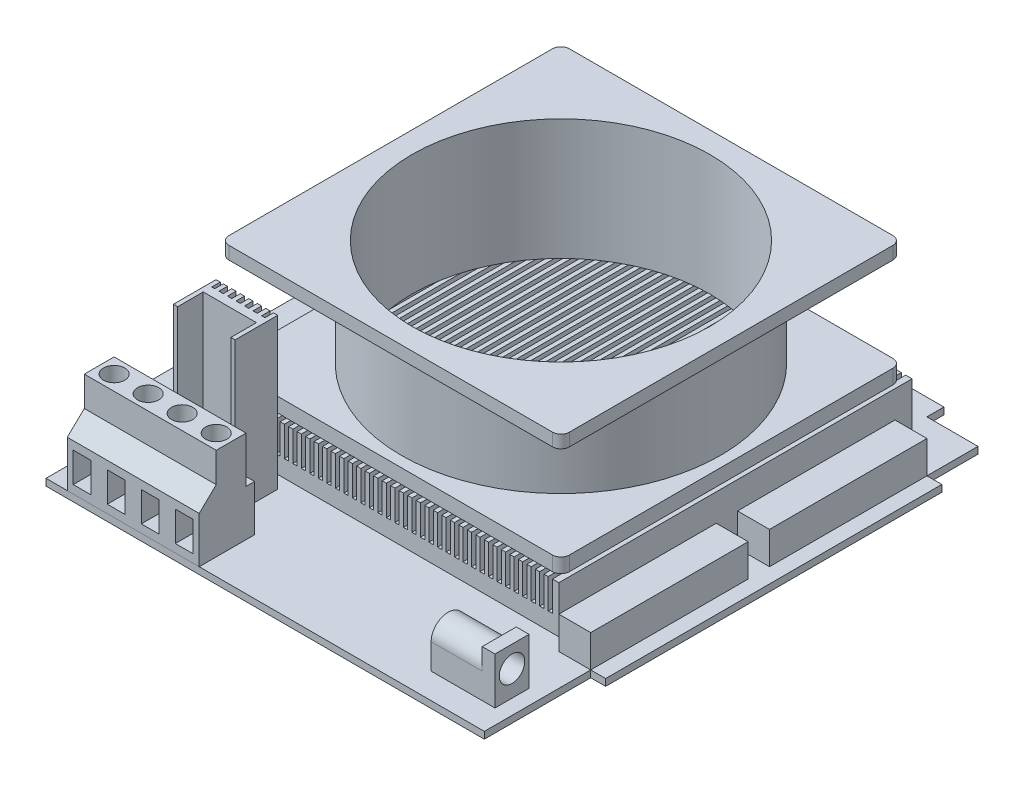
from build123d import *

# Parameters (mm, degrees)
SKETCH_2_W           = 12
SKETCH_2_H           = 25
SKETCH_2_W_2         = 3.5
SKETCH_2_H_2         = 79
SKETCH_2_H_3         = 12
SKETCH_2_W_3         = 79
SKETCH_2_H_4         = 4
EXTRUDE_1_DEPTH      = 1.6
SKETCH_3_W           = 7.5
SKETCH_3_H           = 79
EXTRUDE_2_DEPTH      = 7.6
EXTRUDE_2_2_DEPTH    = 7.6
SKETCH_4_W           = 82
SKETCH_4_H           = 83
EXTRUDE_3_DEPTH      = 11
EXTRUDE_4_DEPTH      = 28.4
SKETCH_8_W           = 1
SKETCH_8_H           = 8
CUT_EXTRUDE_2_DEPTH  = 115.4
SKETCH_6_W           = 31
SKETCH_6_H           = 13
EXTRUDE_5_DEPTH      = 21.7
EXTRUDE_6_DEPTH      = 35.4
SKETCH_9_W           = 130.811120825
SKETCH_9_H           = 105.268753278
SKETCH_9_R           = 37.5
CUT_EXTRUDE_3_DEPTH  = 22
SKETCH_10_R          = 35
CUT_EXTRUDE_4_DEPTH  = 45
SKETCH_11_W          = 103
SKETCH_11_H          = 5
CUT_EXTRUDE_5_DEPTH  = 25
SKETCH_13_W          = 2
SKETCH_13_H          = 10.85
CUT_EXTRUDE_8_DEPTH  = 45
SKETCH_14_R          = 2.5
CUT_EXTRUDE_9_DEPTH  = 15
SKETCH_15_W          = 4.2
SKETCH_15_H          = 7
CUT_EXTRUDE_10_DEPTH = 12
SKETCH_16_W          = 8
SKETCH_16_H          = 11
EXTRUDE_7_DEPTH      = 15
CUT_EXTRUDE_11_DEPTH = 12
SKETCH_18_R          = 3
CUT_EXTRUDE_12_DEPTH = 12


with BuildPart() as part:
    # 草图2 → 凸台-拉伸1 (new body)
    with BuildSketch(Plane(origin=(0, 0, 0), x_dir=(1, 0, 0), z_dir=(0, 1, 0))):
        with Locations((-45.5, -45.5)):
            Rectangle(SKETCH_2_W, SKETCH_2_H)
        with Locations((-53.25, 6.5)):
            Rectangle(SKETCH_2_W_2, SKETCH_2_H_2)
        with Locations((-45.5, 52)):
            Rectangle(SKETCH_2_W, SKETCH_2_H_3)
        with Locations((0, 60)):
            Rectangle(SKETCH_2_W_3, SKETCH_2_H_4)
        with Locations((45.5, 52)):
            Rectangle(SKETCH_2_W, SKETCH_2_H_3)
        with Locations((53.25, 6.5)):
            Rectangle(SKETCH_2_W_2, SKETCH_2_H_2)
        with Locations((45.5, -45.5)):
            Rectangle(SKETCH_2_W, SKETCH_2_H)
        with Locations((0, -45.5)):
            Rectangle(SKETCH_2_W_3, SKETCH_2_H)
        with Locations((0, 6.5)):
            Rectangle(SKETCH_2_W_3, SKETCH_2_H_2)
        with Locations((45.5, 6.5)):
            Rectangle(SKETCH_2_W, SKETCH_2_H_2)
        with Locations((-45.5, 6.5)):
            Rectangle(SKETCH_2_W, SKETCH_2_H_2)
        with Locations((0, 52)):
            Rectangle(SKETCH_2_W_3, SKETCH_2_H_3)
    extrude(amount=EXTRUDE_1_DEPTH)

    # 草图4 → 凸台-拉伸3 (add)
    with BuildSketch(Plane(origin=(0, 1.6, 0), x_dir=(1, 0, 0), z_dir=(0, 1, 0))):
        with Locations((0, 11.5)):
            Rectangle(SKETCH_4_W, SKETCH_4_H)
    extrude(amount=EXTRUDE_3_DEPTH)

    # 草图8 → 切除-拉伸2 (cut)
    with BuildSketch(Plane.XY.offset(30)):
        with Locations((39, 9.6)):
            Rectangle(SKETCH_8_W, SKETCH_8_H)
        with Locations((37, 9.6)):
            Rectangle(SKETCH_8_W, SKETCH_8_H)
        with Locations((35, 9.6)):
            Rectangle(SKETCH_8_W, SKETCH_8_H)
        with Locations((33, 9.6)):
            Rectangle(SKETCH_8_W, SKETCH_8_H)
        with Locations((31, 9.6)):
            Rectangle(SKETCH_8_W, SKETCH_8_H)
        with Locations((29, 9.6)):
            Rectangle(SKETCH_8_W, SKETCH_8_H)
        with Locations((27, 9.6)):
            Rectangle(SKETCH_8_W, SKETCH_8_H)
        with Locations((25, 9.6)):
            Rectangle(SKETCH_8_W, SKETCH_8_H)
        with Locations((23, 9.6)):
            Rectangle(SKETCH_8_W, SKETCH_8_H)
        with Locations((21, 9.6)):
            Rectangle(SKETCH_8_W, SKETCH_8_H)
        with Locations((19, 9.6)):
            Rectangle(SKETCH_8_W, SKETCH_8_H)
        with Locations((17, 9.6)):
            Rectangle(SKETCH_8_W, SKETCH_8_H)
        with Locations((15, 9.6)):
            Rectangle(SKETCH_8_W, SKETCH_8_H)
        with Locations((13, 9.6)):
            Rectangle(SKETCH_8_W, SKETCH_8_H)
        with Locations((11, 9.6)):
            Rectangle(SKETCH_8_W, SKETCH_8_H)
        with Locations((9, 9.6)):
            Rectangle(SKETCH_8_W, SKETCH_8_H)
        with Locations((7, 9.6)):
            Rectangle(SKETCH_8_W, SKETCH_8_H)
        with Locations((5, 9.6)):
            Rectangle(SKETCH_8_W, SKETCH_8_H)
        with Locations((3, 9.6)):
            Rectangle(SKETCH_8_W, SKETCH_8_H)
        with Locations((1, 9.6)):
            Rectangle(SKETCH_8_W, SKETCH_8_H)
        with Locations((-1, 9.6)):
            Rectangle(SKETCH_8_W, SKETCH_8_H)
        with Locations((-3, 9.6)):
            Rectangle(SKETCH_8_W, SKETCH_8_H)
        with Locations((-5, 9.6)):
            Rectangle(SKETCH_8_W, SKETCH_8_H)
        with Locations((-7, 9.6)):
            Rectangle(SKETCH_8_W, SKETCH_8_H)
        with Locations((-9, 9.6)):
            Rectangle(SKETCH_8_W, SKETCH_8_H)
        with Locations((-11, 9.6)):
            Rectangle(SKETCH_8_W, SKETCH_8_H)
        with Locations((-13, 9.6)):
            Rectangle(SKETCH_8_W, SKETCH_8_H)
        with Locations((-15, 9.6)):
            Rectangle(SKETCH_8_W, SKETCH_8_H)
        with Locations((-17, 9.6)):
            Rectangle(SKETCH_8_W, SKETCH_8_H)
        with Locations((-19, 9.6)):
            Rectangle(SKETCH_8_W, SKETCH_8_H)
        with Locations((-21, 9.6)):
            Rectangle(SKETCH_8_W, SKETCH_8_H)
        with Locations((-23, 9.6)):
            Rectangle(SKETCH_8_W, SKETCH_8_H)
        with Locations((-25, 9.6)):
            Rectangle(SKETCH_8_W, SKETCH_8_H)
        with Locations((-27, 9.6)):
            Rectangle(SKETCH_8_W, SKETCH_8_H)
        with Locations((-29, 9.6)):
            Rectangle(SKETCH_8_W, SKETCH_8_H)
        with Locations((-31, 9.6)):
            Rectangle(SKETCH_8_W, SKETCH_8_H)
        with Locations((-33, 9.6)):
            Rectangle(SKETCH_8_W, SKETCH_8_H)
        with Locations((-35, 9.6)):
            Rectangle(SKETCH_8_W, SKETCH_8_H)
        with Locations((-37, 9.6)):
            Rectangle(SKETCH_8_W, SKETCH_8_H)
        with Locations((-39, 9.6)):
            Rectangle(SKETCH_8_W, SKETCH_8_H)
        with Locations((-41, 9.6)):
            Rectangle(SKETCH_8_W, SKETCH_8_H)
        with Locations((-43, 9.6)):
            Rectangle(SKETCH_8_W, SKETCH_8_H)
        with Locations((-45, 9.6)):
            Rectangle(SKETCH_8_W, SKETCH_8_H)
        with Locations((-47, 9.6)):
            Rectangle(SKETCH_8_W, SKETCH_8_H)
        with Locations((-49, 9.6)):
            Rectangle(SKETCH_8_W, SKETCH_8_H)
        with Locations((-51, 9.6)):
            Rectangle(SKETCH_8_W, SKETCH_8_H)
        with Locations((-53, 9.6)):
            Rectangle(SKETCH_8_W, SKETCH_8_H)
        with Locations((-55, 9.6)):
            Rectangle(SKETCH_8_W, SKETCH_8_H)
        with Locations((-57, 9.6)):
            Rectangle(SKETCH_8_W, SKETCH_8_H)
        with Locations((-59, 9.6)):
            Rectangle(SKETCH_8_W, SKETCH_8_H)
    extrude(amount=-CUT_EXTRUDE_2_DEPTH, mode=Mode.SUBTRACT)


with BuildPart() as body_2:
    # 草图3 → 凸台-拉伸2 (new body)
    with BuildSketch(Plane(origin=(0, 1.6, 0), x_dir=(1, 0, 0), z_dir=(0, 1, 0))):
        with Locations((-47.75, 6.5)):
            Rectangle(SKETCH_3_W, SKETCH_3_H)
    extrude(amount=EXTRUDE_2_DEPTH)


with BuildPart() as body_3:
    # 草图3 → Extrude 2 2 (new body)
    with BuildSketch(Plane(origin=(0, 1.6, 0), x_dir=(1, 0, 0), z_dir=(0, 1, 0))):
        with Locations((47.75, 6.5)):
            Rectangle(SKETCH_3_W, SKETCH_3_H)
    extrude(amount=EXTRUDE_2_2_DEPTH)


with BuildPart() as body_4:
    # 草图5 → 凸台-拉伸4 (new body)
    with BuildSketch(Plane(origin=(0, 12.6, 0), x_dir=(1, 0, 0), z_dir=(0, 1, 0))):
        with BuildLine():
            Line((-38, -28.5), (38, -28.5))
            ThreePointArc((38, -28.5), (39.414213562, -27.914213562), (40, -26.5))
            Line((40, -26.5), (40, 49.5))
            ThreePointArc((40, 49.5), (39.414213562, 50.914213562), (38, 51.5))
            Line((38, 51.5), (-38, 51.5))
            ThreePointArc((-38, 51.5), (-39.414213562, 50.914213562), (-40, 49.5))
            Line((-40, 49.5), (-40, -26.5))
            ThreePointArc((-40, -26.5), (-39.414213562, -27.914213562), (-38, -28.5))
        make_face()
    extrude(amount=EXTRUDE_4_DEPTH)

    # 草图9 → 切除-拉伸3 (cut)
    with BuildSketch(Plane(origin=(0, 38, 0), x_dir=(1, 0, 0), z_dir=(0, 1, 0))):
        with Locations((9.725336597, 10.496310544)):
            Rectangle(SKETCH_9_W, SKETCH_9_H)
        with Locations(Location((0, 11.5, 0), (0, 0, 270))):
            Circle(SKETCH_9_R, mode=Mode.SUBTRACT)
    extrude(amount=-CUT_EXTRUDE_3_DEPTH, mode=Mode.SUBTRACT)

    # 草图10 → 切除-拉伸4 (cut)
    with BuildSketch(Plane(origin=(0, 41, 0), x_dir=(1, 0, 0), z_dir=(0, 1, 0))):
        with Locations(Location((0, 11.5, 0), (0, 0, 270))):
            Circle(SKETCH_10_R)
    extrude(amount=-CUT_EXTRUDE_4_DEPTH, mode=Mode.SUBTRACT)


with BuildPart() as body_5:
    # 草图6 → 凸台-拉伸5 (new body)
    with BuildSketch(Plane(origin=(0, 1.6, 0), x_dir=(1, 0, 0), z_dir=(0, 1, 0))):
        with Locations((-31, -51.5)):
            Rectangle(SKETCH_6_W, SKETCH_6_H)
    extrude(amount=EXTRUDE_5_DEPTH)

    # 草图13 → 切除-拉伸8 (cut)
    with BuildSketch(Plane.ZY.offset(46.5)):
        with Locations((46, 17.875)):
            Rectangle(SKETCH_13_W, SKETCH_13_H)
        Polygon((58, 23.3), (54, 23.3), (54, 16.3), (58, 12.45), align=None)
    extrude(amount=-CUT_EXTRUDE_8_DEPTH, mode=Mode.SUBTRACT)

    # 草图14 → 切除-拉伸9 (cut)
    with BuildSketch(Plane(origin=(0, 23.3, 0), x_dir=(1, 0, 0), z_dir=(0, 1, 0))):
        with Locations(Location((-43, -50.5, 0), (0, 0, 270))):
            Circle(SKETCH_14_R)
        with Locations(Location((-35, -50.5, 0), (0, 0, 270))):
            Circle(SKETCH_14_R)
        with Locations(Location((-27, -50.5, 0), (0, 0, 270))):
            Circle(SKETCH_14_R)
        with Locations(Location((-19, -50.5, 0), (0, 0, 270))):
            Circle(SKETCH_14_R)
    extrude(amount=-CUT_EXTRUDE_9_DEPTH, mode=Mode.SUBTRACT)

    # 草图15 → 切除-拉伸10 (cut)
    with BuildSketch(Plane.XY.offset(58)):
        with Locations((-43, 7.025)):
            Rectangle(SKETCH_15_W, SKETCH_15_H)
        with Locations((-35, 7.025)):
            Rectangle(SKETCH_15_W, SKETCH_15_H)
        with Locations((-27, 7.025)):
            Rectangle(SKETCH_15_W, SKETCH_15_H)
        with Locations((-19, 7.025)):
            Rectangle(SKETCH_15_W, SKETCH_15_H)
    extrude(amount=-CUT_EXTRUDE_10_DEPTH, mode=Mode.SUBTRACT)


with BuildPart() as body_6:
    # 草图7 → 凸台-拉伸6 (new body)
    with BuildSketch(Plane(origin=(0, 1.6, 0), x_dir=(1, 0, 0), z_dir=(0, 1, 0))):
        Polygon((-36.550166113, -33), (-36.550166113, -43), (-35.550166113, -43), (-35.550166113, -37), (-23.050166113, -37), (-23.050166113, -43), (-22.050166113, -43), (-22.050166113, -33), (-23.050166113, -33), (-23.050166113, -35), (-23.850166113, -35), (-23.850166113, -33), (-24.850166113, -33), (-24.850166113, -35), (-25.850166113, -35), (-25.850166113, -33), (-26.850166113, -33), (-26.850166113, -35), (-27.850166113, -35), (-27.850166113, -33), (-28.850166113, -33), (-28.850166113, -35), (-29.850166113, -35), (-29.850166113, -33), (-30.850166113, -33), (-30.850166113, -35), (-31.850166113, -35), (-31.850166113, -33), (-32.850166113, -33), (-32.850166113, -35), (-33.850166113, -35), (-33.850166113, -33), (-34.850166113, -33), (-34.850166113, -35), (-35.550166113, -35), (-35.550166113, -33), align=None)
    extrude(amount=EXTRUDE_6_DEPTH)


with BuildPart() as cut_extrude_5_tool:
    # 草图11 → 切除-拉伸5 (new body)
    with BuildSketch(Plane(origin=(0, 9.2, 0), x_dir=(1, 0, 0), z_dir=(0, 1, 0))):
        with Locations((0, 6.5)):
            Rectangle(SKETCH_11_W, SKETCH_11_H)
    extrude(amount=-CUT_EXTRUDE_5_DEPTH)


with BuildPart() as body_3_1:
    add(body_3.part)

    # 切除-拉伸5: cut by cut_extrude_5_tool
    add(cut_extrude_5_tool.part, mode=Mode.SUBTRACT)


with BuildPart() as body_2_1:
    add(body_2.part)

    # 切除-拉伸5: cut by cut_extrude_5_tool
    add(cut_extrude_5_tool.part, mode=Mode.SUBTRACT)


with BuildPart() as cut_extrude_5_piece_1:
    # of the separate pieces the step leaves, piece 1, a body of its own (cut_extrude_5_pieces)
    add(body_2_1.part.solids().sort_by_distance((-51.5, 1.6, -46))[0])


with BuildPart() as cut_extrude_5_piece_2:
    # of the separate pieces the step leaves, piece 2, a body of its own (cut_extrude_5_pieces)
    add(body_2_1.part.solids().sort_by_distance((-51.5, 1.6, 33))[0])


with BuildPart() as cut_extrude_5_piece_1_of_body_3:
    # of the separate pieces the step leaves, piece 1, a body of its own (cut_extrude_5_pieces_of_body_3)
    add(body_3_1.part.solids().sort_by_distance((51.5, 1.6, -46))[0])


with BuildPart() as cut_extrude_5_piece_2_of_body_3:
    # of the separate pieces the step leaves, piece 2, a body of its own (cut_extrude_5_pieces_of_body_3)
    add(body_3_1.part.solids().sort_by_distance((51.5, 1.6, 33))[0])


with BuildPart() as body_9:
    # 草图16 → 凸台-拉伸7 (new body)
    with BuildSketch(Plane(origin=(48, 0, 0), x_dir=(0, 0, -1), z_dir=(1, 0, 0))):
        with Locations((-48, 7.1)):
            Rectangle(SKETCH_16_W, SKETCH_16_H)
    extrude(amount=-EXTRUDE_7_DEPTH)

    # 草图17 → 切除-拉伸11 (cut)
    with BuildSketch(Plane.ZY.offset(-33)):
        with BuildLine():
            Line((52, 12.6), (44, 12.6))
            Line((44, 12.6), (44, 7.6))
            ThreePointArc((44, 7.6), (48, 11.6), (52, 7.6))
            Line((52, 7.6), (52, 12.6))
        make_face()
    extrude(amount=-CUT_EXTRUDE_11_DEPTH, mode=Mode.SUBTRACT)

    # 草图18 → 切除-拉伸12 (cut)
    with BuildSketch(Plane(origin=(48, 0, 0), x_dir=(0, 0, -1), z_dir=(1, 0, 0))):
        with Locations((-48, 7.6)):
            Circle(SKETCH_18_R)
    extrude(amount=-CUT_EXTRUDE_12_DEPTH, mode=Mode.SUBTRACT)


solid = Compound([part.part, body_4.part, body_5.part, body_6.part, cut_extrude_5_piece_1.part, cut_extrude_5_piece_2.part, cut_extrude_5_piece_1_of_body_3.part, cut_extrude_5_piece_2_of_body_3.part, body_9.part])
